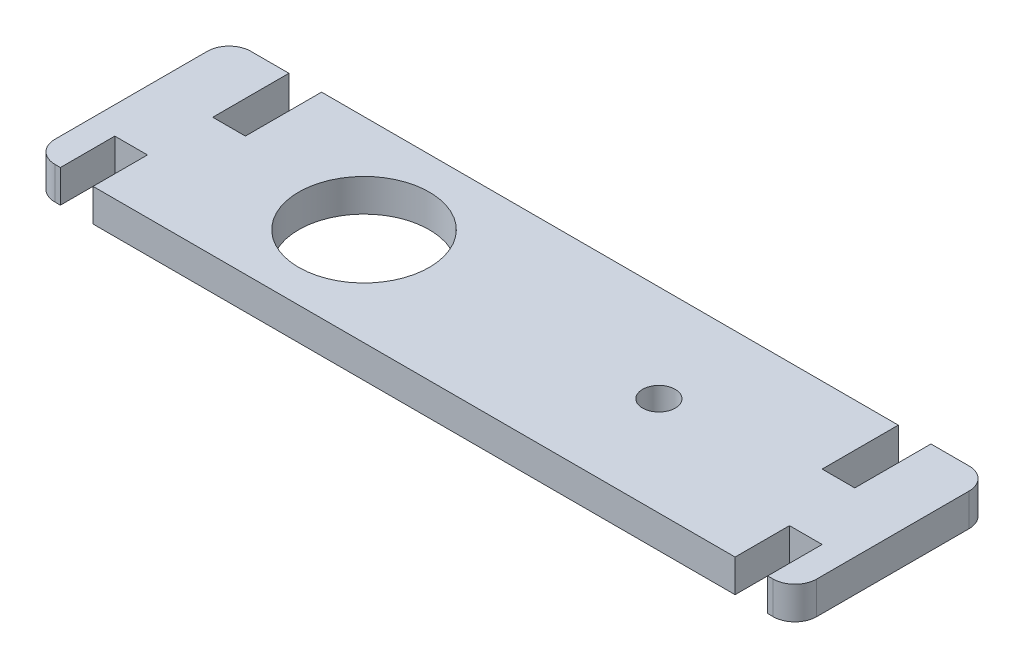
from build123d import *

# Parameters (mm, degrees)
BOSS_EXTRUDE1_DEPTH = 3
SKETCH6_W           = 3
SKETCH6_H           = 7
CUT_EXTRUDE3_DEPTH  = 3
SKETCH7_R           = 1.5
CUT_EXTRUDE4_DEPTH  = 3
SKETCH8_W           = 3
SKETCH8_H           = 5
CUT_EXTRUDE5_DEPTH  = 3
SKETCH9_R           = 6
CUT_EXTRUDE6_DEPTH  = 3


with BuildPart() as part:
    # Sketch2 → Boss-Extrude1 (new body)
    with BuildSketch(Plane(origin=(0, 0, 0), x_dir=(1, 0, 0), z_dir=(0, 1, 0))):
        with BuildLine():
            Line((-3.583885407, 15.877073113), (62.416114593, 15.877073113))
            ThreePointArc((62.416114593, 15.877073113), (63.830328155, 15.291286675), (64.416114593, 13.877073113))
            Line((64.416114593, 13.877073113), (64.416114593, -0.122926887))
            ThreePointArc((64.416114593, -0.122926887), (63.830328155, -1.53714045), (62.416114593, -2.122926887))
            Line((62.416114593, -2.122926887), (-3.583885407, -2.122926887))
            ThreePointArc((-3.583885407, -2.122926887), (-4.99809897, -1.53714045), (-5.583885407, -0.122926887))
            Line((-5.583885407, -0.122926887), (-5.583885407, 13.877073113))
            ThreePointArc((-5.583885407, 13.877073113), (-4.99809897, 15.291286675), (-3.583885407, 15.877073113))
        make_face()
    extrude(amount=BOSS_EXTRUDE1_DEPTH)

    # Sketch6 → Cut-Extrude3 (cut)
    with BuildSketch(Plane(origin=(0, 3, 0), x_dir=(1, 0, 0), z_dir=(0, 1, 0))):
        with Locations((1.416114593, 12.377073113)):
            Rectangle(SKETCH6_W, SKETCH6_H)
        with Locations((57.416114593, 12.377073113)):
            Rectangle(SKETCH6_W, SKETCH6_H)
    extrude(amount=-CUT_EXTRUDE3_DEPTH, mode=Mode.SUBTRACT)

    # Sketch7 → Cut-Extrude4 (cut)
    with BuildSketch(Plane(origin=(0, 3, 0), x_dir=(1, 0, 0), z_dir=(0, 1, 0))):
        with Locations(Location((42.816114593, 6.977073113, 0), (0, 0, 270))):
            Circle(SKETCH7_R)
    extrude(amount=-CUT_EXTRUDE4_DEPTH, mode=Mode.SUBTRACT)

    # Sketch8 → Cut-Extrude5 (cut)
    with BuildSketch(Plane(origin=(0, 3, 0), x_dir=(1, 0, 0), z_dir=(0, 1, 0))):
        with Locations((60.416114593, 0.377073113)):
            Rectangle(SKETCH8_W, SKETCH8_H)
        with Locations((-1.583885407, 0.377073113)):
            Rectangle(SKETCH8_W, SKETCH8_H)
    extrude(amount=-CUT_EXTRUDE5_DEPTH, mode=Mode.SUBTRACT)

    # Sketch9 → Cut-Extrude6 (cut)
    with BuildSketch(Plane(origin=(0, 3, 0), x_dir=(1, 0, 0), z_dir=(0, 1, 0))):
        with Locations(Location((15.816114593, 6.877073113, 0), (0, 0, 270))):
            Circle(SKETCH9_R)
    extrude(amount=-CUT_EXTRUDE6_DEPTH, mode=Mode.SUBTRACT)


solid = part.part
